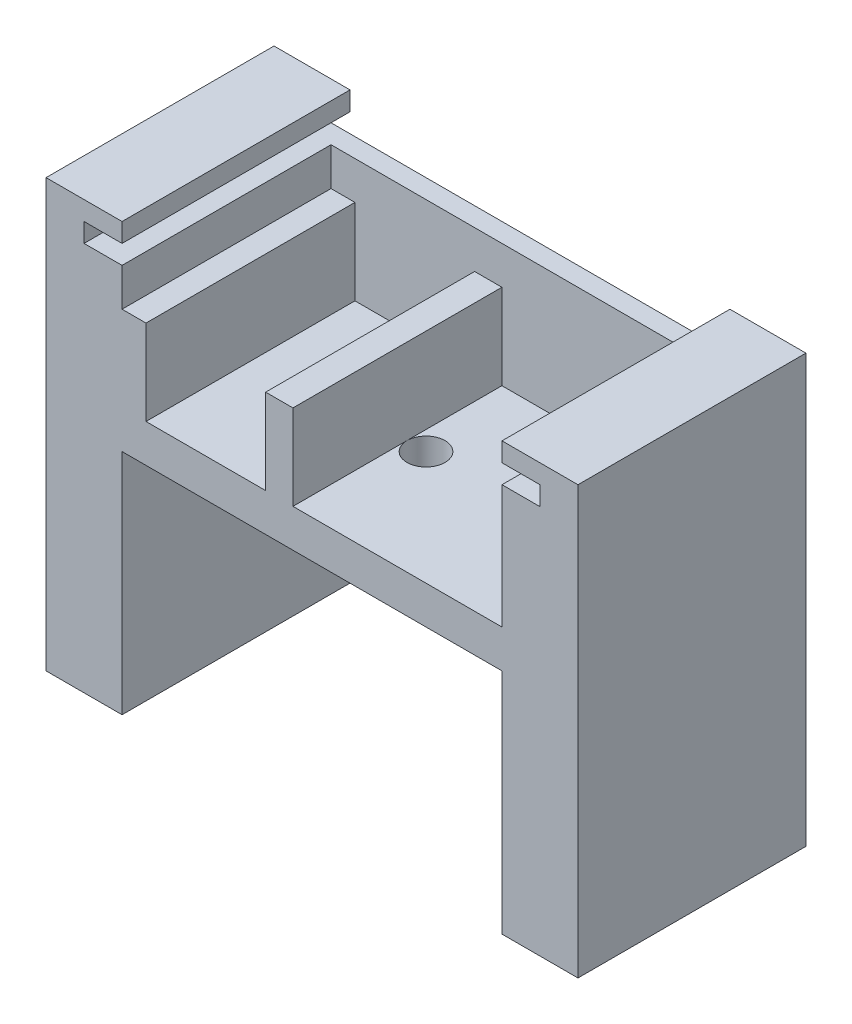
from build123d import *

# Parameters (mm, degrees)
BOSS_EXTRUDE1_DEPTH = 76.2
SKETCH2_W           = 6.35
SKETCH2_H           = 41.2
BOSS_EXTRUDE2_DEPTH = 127
SKETCH3_R           = 6.35
CUT_EXTRUDE1_DEPTH  = 105.2


with BuildPart() as part:
    # Sketch1 → Boss-Extrude1 (new body)
    with BuildSketch(Plane.XY):
        Polygon((-63.5, 0), (63.5, 0), (63.5, -76.2), (88.9, -76.2), (88.9, 66.6), (63.5, 66.6), (63.5, 60.25), (76.2, 60.25), (76.2, 53.9), (63.5, 53.9), (63.5, 12.7), (-6.371461067, 12.7), (-6.371461067, 41.2), (-15.5, 41.2), (-15.5, 12.7), (-55.5, 12.7), (-55.5, 41.2), (-63.5, 41.2), (-63.5, 53.9), (-76.2, 53.9), (-76.2, 60.25), (-63.5, 60.25), (-63.5, 66.6), (-88.9, 66.6), (-88.9, -76.2), (-63.5, -76.2), align=None)
    extrude(amount=BOSS_EXTRUDE1_DEPTH)

    # Sketch2 → Boss-Extrude2 (add)
    with BuildSketch(Plane.ZY.offset(-63.5)):
        with Locations((3.175, 33.3)):
            Rectangle(SKETCH2_W, SKETCH2_H)
    extrude(amount=BOSS_EXTRUDE2_DEPTH)

    # Sketch3 → Cut-Extrude1 (cut)
    with BuildSketch(Plane.XZ):
        with Locations(Location((0, 38.1, 0), (0, 0, 270))):
            Circle(SKETCH3_R)
    extrude(amount=-CUT_EXTRUDE1_DEPTH, mode=Mode.SUBTRACT)


solid = part.part
